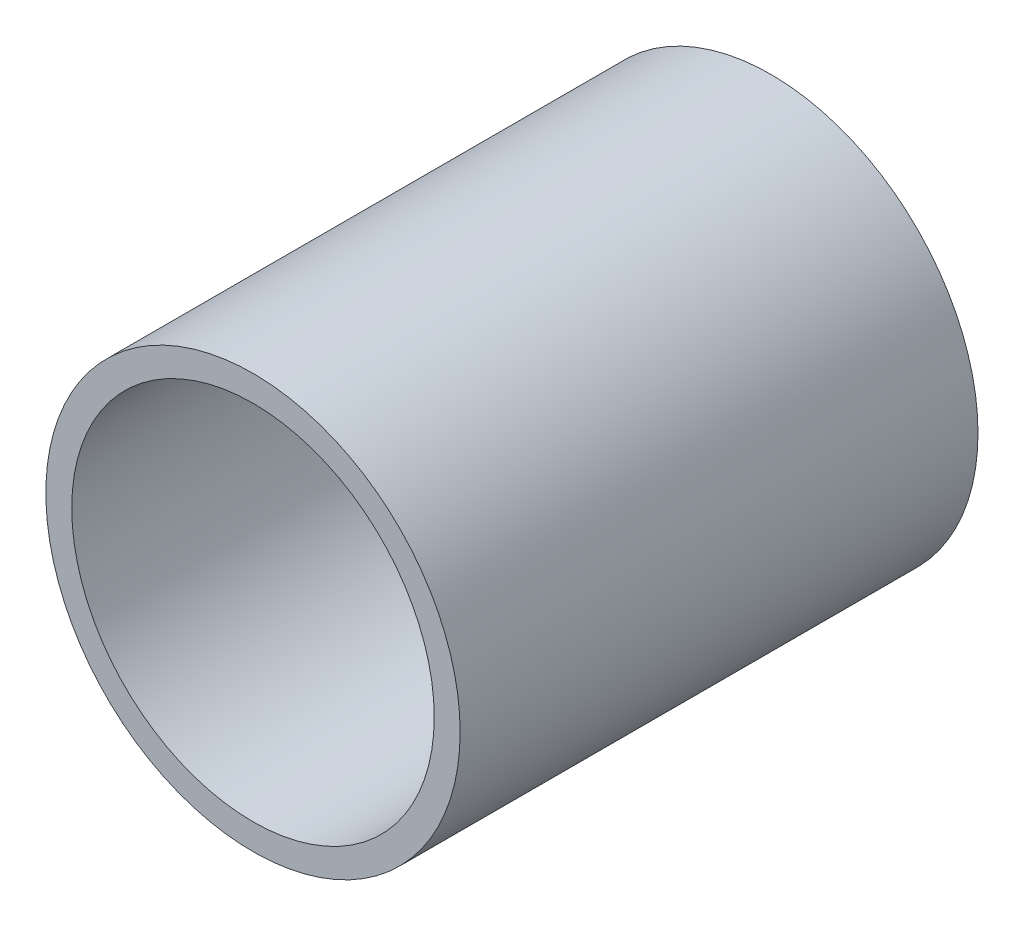
from build123d import *

# Parameters (mm, degrees)
CROQUIS1_R              = 4
CROQUIS1_R_2            = 3.5
SALIENTE_EXTRUIR1_DEPTH = 10


with BuildPart() as part:
    # Croquis1 → Saliente-Extruir1 (new body)
    with BuildSketch(Plane.XY):
        Circle(CROQUIS1_R)
        Circle(CROQUIS1_R_2, mode=Mode.SUBTRACT)
    extrude(amount=SALIENTE_EXTRUIR1_DEPTH)


solid = part.part
